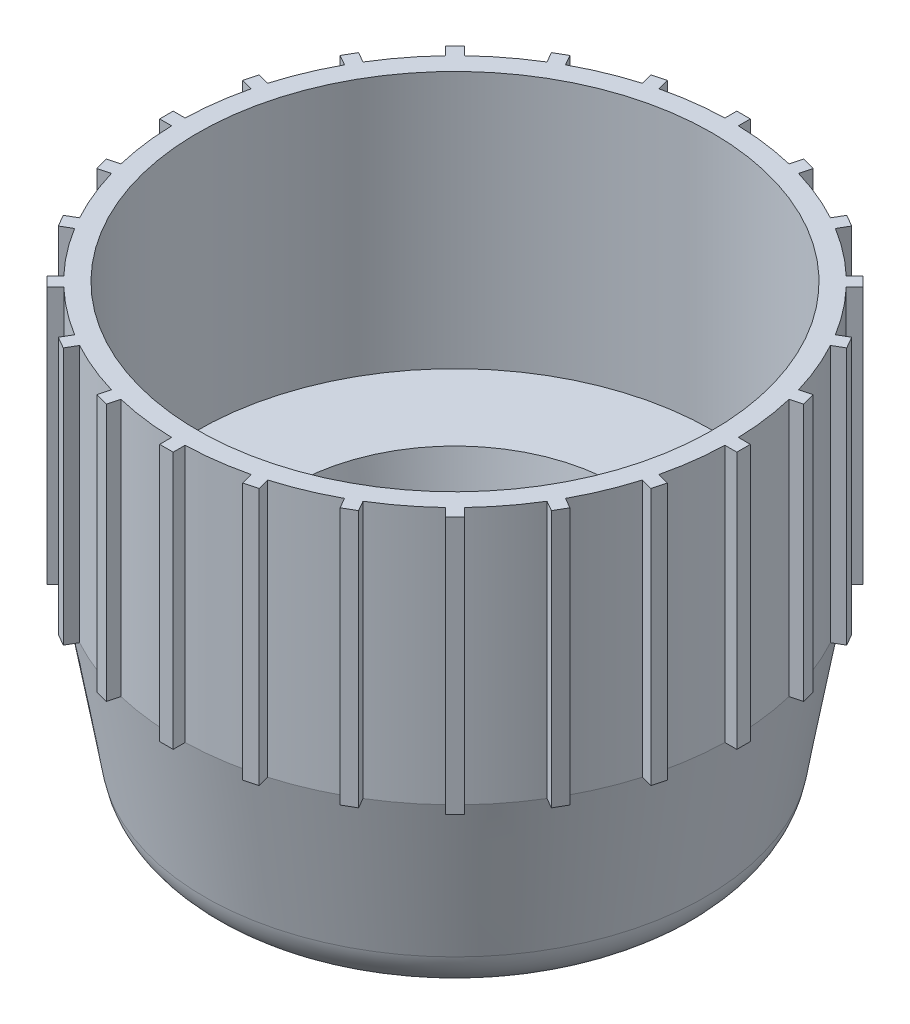
from build123d import *

# Parameters (mm, degrees)
BOSS_EXTRUDE1_DEPTH = 20


with BuildPart() as part:
    # Sketch1 → Revolve1 (revolve)
    with BuildSketch(Plane.XY, mode=Mode.PRIVATE) as revolve1_sk:
        with BuildLine():
            Line((12.644904711, 15), (10, 0))
            Line((10, 0), (15.498696765, 0))
            ThreePointArc((15.498696765, 0), (18.069847203, 0.935822228), (19.437927777, 3.305407289))
            Line((19.437927777, 3.305407289), (21.5, 15))
            Line((21.5, 15), (21.5, 35))
            Line((21.5, 35), (20, 35))
            Line((20, 35), (20, 15))
            Line((20, 15), (12.644904711, 15))
        make_face()
    revolve(revolve1_sk.sketch.rotate(Axis((0, 0, 0), (0, 1, 0)), 90), axis=Axis((0, 0, 0), (0, 1, 0)))

    # Sketch2 → Boss-Extrude1 (add)
    with BuildSketch(Plane(origin=(0, 35, 0), x_dir=(1, 0, 0), z_dir=(0, 1, 0))):
        with BuildLine():
            Line((21.49358916, -0.525), (22.42, -0.525))
            Line((22.42, -0.525), (22.42, 0.525))
            Line((22.42, 0.525), (21.49358916, 0.525))
            ThreePointArc((21.49358916, 0.525), (21.5, 0), (21.49358916, -0.525))
        make_face()
        with BuildLine():
            Line((20.625332871, -6.070061281), (21.520177027, -6.30983405))
            Line((21.520177027, -6.30983405), (21.791937024, -5.295611932))
            Line((21.791937024, -5.295611932), (20.897092868, -5.055839164))
            ThreePointArc((20.897092868, -5.055839164), (20.767405265, -5.56460947), (20.625332871, -6.070061281))
        make_face()
        with BuildLine():
            Line((18.351494231, -11.201457917), (19.153789553, -11.664663337))
            Line((19.153789553, -11.664663337), (19.678789553, -10.755336663))
            Line((19.678789553, -10.755336663), (18.876494231, -10.292131243))
            ThreePointArc((18.876494231, -10.292131243), (18.619546181, -10.75), (18.351494231, -11.201457917))
        make_face()
        with BuildLine():
            Line((14.827031587, -15.569493708), (15.482102974, -16.224565094))
            Line((15.482102974, -16.224565094), (16.224565094, -15.482102974))
            Line((16.224565094, -15.482102974), (15.569493708, -14.827031587))
            ThreePointArc((15.569493708, -14.827031587), (15.202795796, -15.202795796), (14.827031587, -15.569493708))
        make_face()
        with BuildLine():
            Line((10.292131243, -18.876494231), (10.755336663, -19.678789553))
            Line((10.755336663, -19.678789553), (11.664663337, -19.153789553))
            Line((11.664663337, -19.153789553), (11.201457917, -18.351494231))
            ThreePointArc((11.201457917, -18.351494231), (10.75, -18.619546181), (10.292131243, -18.876494231))
        make_face()
        with BuildLine():
            Line((5.055839164, -20.897092868), (5.295611932, -21.791937024))
            Line((5.295611932, -21.791937024), (6.30983405, -21.520177027))
            Line((6.30983405, -21.520177027), (6.070061281, -20.625332871))
            ThreePointArc((6.070061281, -20.625332871), (5.56460947, -20.767405265), (5.055839164, -20.897092868))
        make_face()
        with BuildLine():
            Line((-0.525, -21.49358916), (-0.525, -22.42))
            Line((-0.525, -22.42), (0.525, -22.42))
            Line((0.525, -22.42), (0.525, -21.49358916))
            ThreePointArc((0.525, -21.49358916), (0, -21.5), (-0.525, -21.49358916))
        make_face()
        with BuildLine():
            Line((-6.070061281, -20.625332871), (-6.30983405, -21.520177027))
            Line((-6.30983405, -21.520177027), (-5.295611932, -21.791937024))
            Line((-5.295611932, -21.791937024), (-5.055839164, -20.897092868))
            ThreePointArc((-5.055839164, -20.897092868), (-5.56460947, -20.767405265), (-6.070061281, -20.625332871))
        make_face()
        with BuildLine():
            Line((-11.201457917, -18.351494231), (-11.664663337, -19.153789553))
            Line((-11.664663337, -19.153789553), (-10.755336663, -19.678789553))
            Line((-10.755336663, -19.678789553), (-10.292131243, -18.876494231))
            ThreePointArc((-10.292131243, -18.876494231), (-10.75, -18.619546181), (-11.201457917, -18.351494231))
        make_face()
        with BuildLine():
            Line((-15.569493708, -14.827031587), (-16.224565094, -15.482102974))
            Line((-16.224565094, -15.482102974), (-15.482102974, -16.224565094))
            Line((-15.482102974, -16.224565094), (-14.827031587, -15.569493708))
            ThreePointArc((-14.827031587, -15.569493708), (-15.202795796, -15.202795796), (-15.569493708, -14.827031587))
        make_face()
        with BuildLine():
            Line((-18.876494231, -10.292131243), (-19.678789553, -10.755336663))
            Line((-19.678789553, -10.755336663), (-19.153789553, -11.664663337))
            Line((-19.153789553, -11.664663337), (-18.351494231, -11.201457917))
            ThreePointArc((-18.351494231, -11.201457917), (-18.619546181, -10.75), (-18.876494231, -10.292131243))
        make_face()
        with BuildLine():
            Line((-20.897092868, -5.055839164), (-21.791937024, -5.295611932))
            Line((-21.791937024, -5.295611932), (-21.520177027, -6.30983405))
            Line((-21.520177027, -6.30983405), (-20.625332871, -6.070061281))
            ThreePointArc((-20.625332871, -6.070061281), (-20.767405265, -5.56460947), (-20.897092868, -5.055839164))
        make_face()
        with BuildLine():
            Line((-21.49358916, 0.525), (-22.42, 0.525))
            Line((-22.42, 0.525), (-22.42, -0.525))
            Line((-22.42, -0.525), (-21.49358916, -0.525))
            ThreePointArc((-21.49358916, -0.525), (-21.5, 0), (-21.49358916, 0.525))
        make_face()
        with BuildLine():
            Line((-20.625332871, 6.070061281), (-21.520177027, 6.30983405))
            Line((-21.520177027, 6.30983405), (-21.791937024, 5.295611932))
            Line((-21.791937024, 5.295611932), (-20.897092868, 5.055839164))
            ThreePointArc((-20.897092868, 5.055839164), (-20.767405265, 5.56460947), (-20.625332871, 6.070061281))
        make_face()
        with BuildLine():
            Line((-18.351494231, 11.201457917), (-19.153789553, 11.664663337))
            Line((-19.153789553, 11.664663337), (-19.678789553, 10.755336663))
            Line((-19.678789553, 10.755336663), (-18.876494231, 10.292131243))
            ThreePointArc((-18.876494231, 10.292131243), (-18.619546181, 10.75), (-18.351494231, 11.201457917))
        make_face()
        with BuildLine():
            Line((-14.827031587, 15.569493708), (-15.482102974, 16.224565094))
            Line((-15.482102974, 16.224565094), (-16.224565094, 15.482102974))
            Line((-16.224565094, 15.482102974), (-15.569493708, 14.827031587))
            ThreePointArc((-15.569493708, 14.827031587), (-15.202795796, 15.202795796), (-14.827031587, 15.569493708))
        make_face()
        with BuildLine():
            Line((-10.292131243, 18.876494231), (-10.755336663, 19.678789553))
            Line((-10.755336663, 19.678789553), (-11.664663337, 19.153789553))
            Line((-11.664663337, 19.153789553), (-11.201457917, 18.351494231))
            ThreePointArc((-11.201457917, 18.351494231), (-10.75, 18.619546181), (-10.292131243, 18.876494231))
        make_face()
        with BuildLine():
            Line((-5.055839164, 20.897092868), (-5.295611932, 21.791937024))
            Line((-5.295611932, 21.791937024), (-6.30983405, 21.520177027))
            Line((-6.30983405, 21.520177027), (-6.070061281, 20.625332871))
            ThreePointArc((-6.070061281, 20.625332871), (-5.56460947, 20.767405265), (-5.055839164, 20.897092868))
        make_face()
        with BuildLine():
            Line((0.525, 21.49358916), (0.525, 22.42))
            Line((0.525, 22.42), (-0.525, 22.42))
            Line((-0.525, 22.42), (-0.525, 21.49358916))
            ThreePointArc((-0.525, 21.49358916), (0, 21.5), (0.525, 21.49358916))
        make_face()
        with BuildLine():
            Line((6.070061281, 20.625332871), (6.30983405, 21.520177027))
            Line((6.30983405, 21.520177027), (5.295611932, 21.791937024))
            Line((5.295611932, 21.791937024), (5.055839164, 20.897092868))
            ThreePointArc((5.055839164, 20.897092868), (5.56460947, 20.767405265), (6.070061281, 20.625332871))
        make_face()
        with BuildLine():
            Line((11.201457917, 18.351494231), (11.664663337, 19.153789553))
            Line((11.664663337, 19.153789553), (10.755336663, 19.678789553))
            Line((10.755336663, 19.678789553), (10.292131243, 18.876494231))
            ThreePointArc((10.292131243, 18.876494231), (10.75, 18.619546181), (11.201457917, 18.351494231))
        make_face()
        with BuildLine():
            Line((15.569493708, 14.827031587), (16.224565094, 15.482102974))
            Line((16.224565094, 15.482102974), (15.482102974, 16.224565094))
            Line((15.482102974, 16.224565094), (14.827031587, 15.569493708))
            ThreePointArc((14.827031587, 15.569493708), (15.202795796, 15.202795796), (15.569493708, 14.827031587))
        make_face()
        with BuildLine():
            Line((18.876494231, 10.292131243), (19.678789553, 10.755336663))
            Line((19.678789553, 10.755336663), (19.153789553, 11.664663337))
            Line((19.153789553, 11.664663337), (18.351494231, 11.201457917))
            ThreePointArc((18.351494231, 11.201457917), (18.619546181, 10.75), (18.876494231, 10.292131243))
        make_face()
        with BuildLine():
            Line((20.897092868, 5.055839164), (21.791937024, 5.295611932))
            Line((21.791937024, 5.295611932), (21.520177027, 6.30983405))
            Line((21.520177027, 6.30983405), (20.625332871, 6.070061281))
            ThreePointArc((20.625332871, 6.070061281), (20.767405265, 5.56460947), (20.897092868, 5.055839164))
        make_face()
    extrude(amount=-BOSS_EXTRUDE1_DEPTH)


solid = part.part
